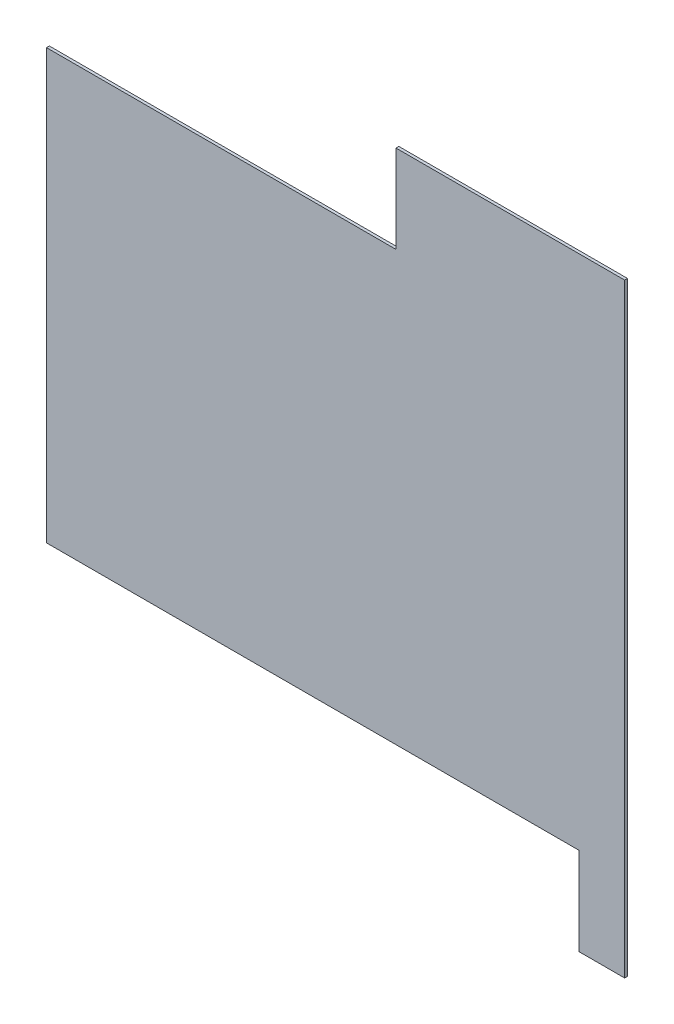
from build123d import *

# Parameters (mm, degrees)
BOSS_EXTRUDE1_DEPTH = 10
CUT_EXTRUDE2_DEPTH  = 330
SKETCH4_W           = 178
SKETCH4_H           = 12
CUT_EXTRUDE3_DEPTH  = 2730.484566727
SKETCH5_W           = 12
SKETCH5_H           = 309
CUT_EXTRUDE4_DEPTH  = 10


with BuildPart() as part:
    # Sketch1 → Boss-Extrude1 (new body)
    with BuildSketch(Plane.XY):
        Polygon((1230, 1510), (0, 1510), (0, 0), (1685, 0), (1685, -309), (2035, -309), (2035, 1819), (1230, 1819), align=None)
    extrude(amount=BOSS_EXTRUDE1_DEPTH)

    # Sketch3 → Cut-Extrude2 (cut)
    with BuildSketch(Plane(origin=(-124.112118138, -342, 1004.457487155), x_dir=(-1, 0, 0), z_dir=(0, -1, 0))):
        with BuildLine():
            Line((-1887.112118138, 819.457487155), (-1466.112118138, 819.457487155))
            ThreePointArc((-1466.112118138, 819.457487155), (-1395.40144002, 848.746809036), (-1366.112118138, 919.457487155))
            Line((-1366.112118138, 919.457487155), (-1366.112118138, 2569.457487155))
            ThreePointArc((-1366.112118138, 2569.457487155), (-1395.40144002, 2640.168165273), (-1466.112118138, 2669.457487155))
            Line((-1466.112118138, 2669.457487155), (-1887.112118138, 2669.457487155))
            ThreePointArc((-1887.112118138, 2669.457487155), (-1957.822796257, 2640.168165273), (-1987.112118138, 2569.457487155))
            Line((-1987.112118138, 2569.457487155), (-1987.112118138, 919.457487155))
            ThreePointArc((-1987.112118138, 919.457487155), (-1957.822796257, 848.746809036), (-1887.112118138, 819.457487155))
        make_face()
    extrude(amount=-CUT_EXTRUDE2_DEPTH, mode=Mode.SUBTRACT)

    # Sketch4 → Cut-Extrude3 (cut, through all)
    with BuildSketch(Plane(origin=(0, 0, 0), x_dir=(-1, 0, 0), z_dir=(0, 0, -1))):
        with Locations((-1774, -6)):
            Rectangle(SKETCH4_W, SKETCH4_H)
    extrude(amount=-CUT_EXTRUDE3_DEPTH, mode=Mode.SUBTRACT)

    # Sketch5 → Cut-Extrude4 (cut)
    with BuildSketch(Plane(origin=(0, 0, 0), x_dir=(-1, 0, 0), z_dir=(0, 0, -1))):
        with Locations((-1869, -154.5)):
            Rectangle(SKETCH5_W, SKETCH5_H)
    extrude(amount=-CUT_EXTRUDE4_DEPTH, mode=Mode.SUBTRACT)


solid = part.part
